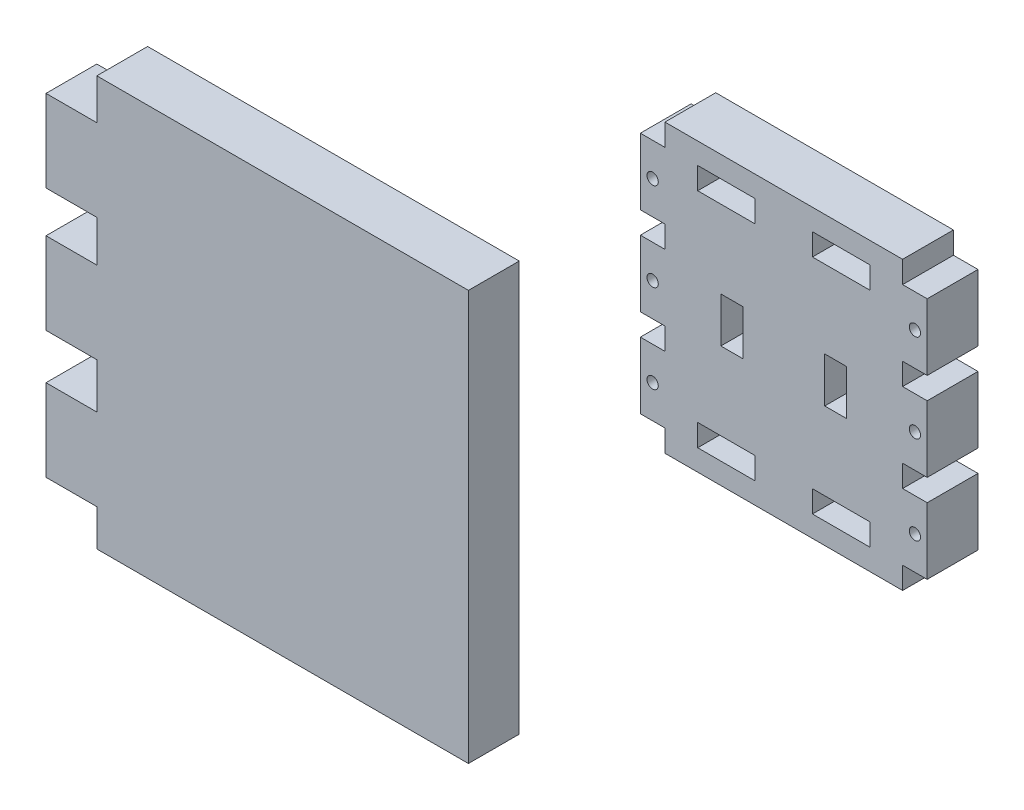
from build123d import *

# Parameters (mm, degrees)
MODEL_R               = 1.375
MODEL_W               = 14
MODEL_H               = 5.35
MODEL_W_2             = 5.35
MODEL_H_2             = 11
BOSS_EXTRUDE1_DEPTH   = 12.4
BOSS_EXTRUDE1_2_DEPTH = 12.4


with BuildPart() as part:
    # Model → Boss-Extrude1 (new body)
    with BuildSketch(Plane.XY):
        Polygon((93.296383478, 89.545101684), (151.296383478, 89.545101684), (151.296383478, 94.895101684), (157.296383478, 94.895101684), (157.296383478, 111.095101684), (151.296383478, 111.095101684), (151.296383478, 116.445101684), (157.296383478, 116.445101684), (157.296383478, 132.645101684), (151.296383478, 132.645101684), (151.296383478, 137.995101684), (157.296383478, 137.995101684), (157.296383478, 154.195101684), (151.296383478, 154.195101684), (151.296383478, 159.545101684), (93.296383478, 159.545101684), (93.296383478, 154.195101684), (87.296383478, 154.195101684), (87.296383478, 137.995101684), (93.296383478, 137.995101684), (93.296383478, 132.645101684), (87.296383478, 132.645101684), (87.296383478, 116.445101684), (93.296383478, 116.445101684), (93.296383478, 111.095101684), (87.296383478, 111.095101684), (87.296383478, 94.895101684), (93.296383478, 94.895101684), align=None)
        with Locations(Location((90.296383478, 146.095101684, 0), (0, 0, 180))):
            Circle(MODEL_R, mode=Mode.SUBTRACT)
        with Locations(Location((154.296383478, 146.095101684, 0), (0, 0, 180))):
            Circle(MODEL_R, mode=Mode.SUBTRACT)
        with Locations(Location((154.296383478, 102.995101684, 0), (0, 0, 180))):
            Circle(MODEL_R, mode=Mode.SUBTRACT)
        with Locations(Location((90.296383478, 102.995101684, 0), (0, 0, 180))):
            Circle(MODEL_R, mode=Mode.SUBTRACT)
        with Locations(Location((90.296383478, 124.545101684, 0), (0, 0, 180))):
            Circle(MODEL_R, mode=Mode.SUBTRACT)
        with Locations(Location((154.296383478, 124.545101684, 0), (0, 0, 180))):
            Circle(MODEL_R, mode=Mode.SUBTRACT)
        with Locations((108.296383478, 151.700101684)):
            Rectangle(MODEL_W, MODEL_H, mode=Mode.SUBTRACT)
        with Locations((136.296383478, 151.700101684)):
            Rectangle(MODEL_W, MODEL_H, mode=Mode.SUBTRACT)
        with Locations((136.296383478, 97.390101684)):
            Rectangle(MODEL_W, MODEL_H, mode=Mode.SUBTRACT)
        with Locations((108.296383478, 97.390101684)):
            Rectangle(MODEL_W, MODEL_H, mode=Mode.SUBTRACT)
        with Locations((109.621383478, 124.545101684)):
            Rectangle(MODEL_W_2, MODEL_H_2, mode=Mode.SUBTRACT)
        with Locations((134.971383478, 124.545101684)):
            Rectangle(MODEL_W_2, MODEL_H_2, mode=Mode.SUBTRACT)
    extrude(amount=BOSS_EXTRUDE1_DEPTH)


with BuildPart() as body_2:
    # Model → Boss-Extrude1 2 (new body)
    with BuildSketch(Plane.XY):
        Polygon((-45.343128598, 90.090149077), (-57.743128598, 90.090149077), (-57.743128598, 70.090149077), (-45.343128598, 70.090149077), (-45.343128598, 60), (-57.743128598, 60), (-57.743128598, 40), (-45.343128598, 40), (-45.343128598, 28.943501612), (-57.743128598, 28.943501612), (-57.743128598, 8.943501612), (-45.343128598, 8.943501612), (-45.343128598, 0), (45.343128598, 0), (45.343128598, 100), (-45.343128598, 100), align=None)
    extrude(amount=BOSS_EXTRUDE1_2_DEPTH)


solid = Compound([part.part, body_2.part])
